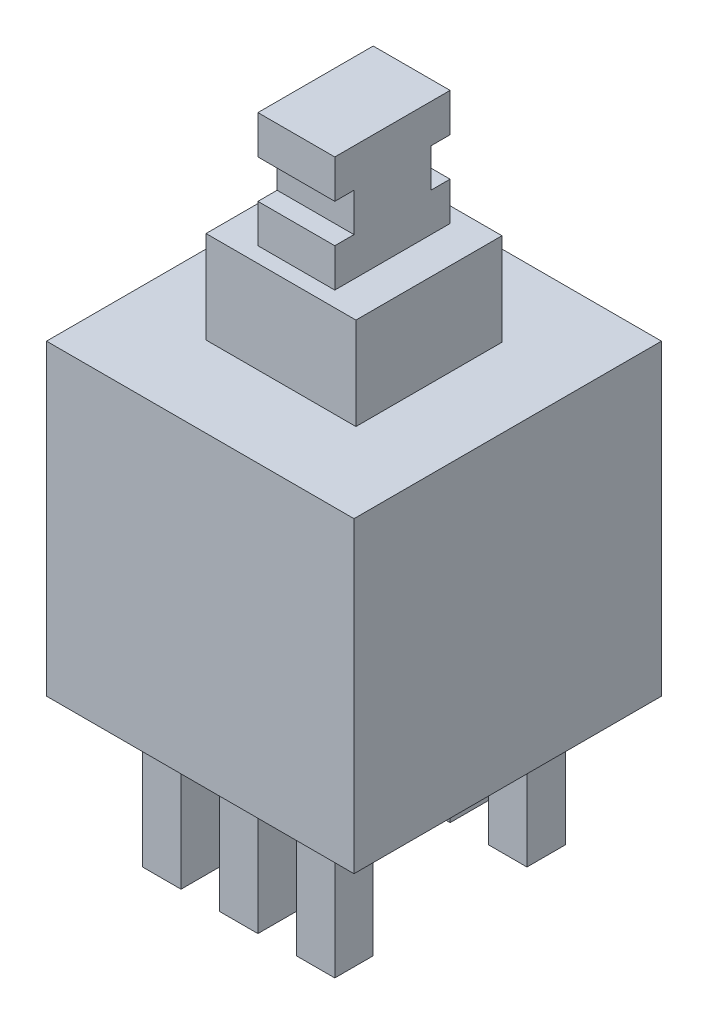
from build123d import *

# Parameters (mm, degrees)
SKETCH1_W           = 8
SKETCH1_H           = 8
BOSS_EXTRUDE1_DEPTH = 8
SKETCH2_W           = 3.9
SKETCH2_H           = 3.8
BOSS_EXTRUDE2_DEPTH = 2.4
SKETCH3_W           = 2
SKETCH3_H           = 3
BOSS_EXTRUDE3_DEPTH = 3
SKETCH4_W           = 1
SKETCH4_H           = 1
BOSS_EXTRUDE4_DEPTH = 3.6
SKETCH5_W           = 0.5
SKETCH5_H           = 1
CUT_EXTRUDE1_DEPTH  = 15.851262573


with BuildPart() as part:
    # Sketch1 → Boss-Extrude1 (new body)
    with BuildSketch(Plane(origin=(0, 0, 0), x_dir=(1, 0, 0), z_dir=(0, 1, 0))):
        Rectangle(SKETCH1_W, SKETCH1_H)
    extrude(amount=BOSS_EXTRUDE1_DEPTH)

    # Sketch2 → Boss-Extrude2 (add)
    with BuildSketch(Plane(origin=(0, 8, 0), x_dir=(1, 0, 0), z_dir=(0, 1, 0))):
        Rectangle(SKETCH2_W, SKETCH2_H)
    extrude(amount=BOSS_EXTRUDE2_DEPTH)

    # Sketch3 → Boss-Extrude3 (add)
    with BuildSketch(Plane(origin=(0, 10.4, 0), x_dir=(1, 0, 0), z_dir=(0, 1, 0))):
        Rectangle(SKETCH3_W, SKETCH3_H)
    extrude(amount=BOSS_EXTRUDE3_DEPTH)

    # Sketch4 → Boss-Extrude4 (add)
    with BuildSketch(Plane.XZ):
        with Locations((0, 2.5)):
            Rectangle(SKETCH4_W, SKETCH4_H)
        with Locations((-2, 2.5)):
            Rectangle(SKETCH4_W, SKETCH4_H)
        with Locations((2, 2.5)):
            Rectangle(SKETCH4_W, SKETCH4_H)
        with Locations((0, -2.5)):
            Rectangle(SKETCH4_W, SKETCH4_H)
        with Locations((2, -2.5)):
            Rectangle(SKETCH4_W, SKETCH4_H)
        with Locations((-2, -2.5)):
            Rectangle(SKETCH4_W, SKETCH4_H)
    extrude(amount=BOSS_EXTRUDE4_DEPTH)

    # Sketch5 → Cut-Extrude1 (cut, through all)
    with BuildSketch(Plane(origin=(1, 0, 0), x_dir=(0, 0, -1), z_dir=(1, 0, 0))):
        with Locations((-1.25, 11.9)):
            Rectangle(SKETCH5_W, SKETCH5_H)
        with Locations((1.25, 11.9)):
            Rectangle(SKETCH5_W, SKETCH5_H)
    extrude(amount=-CUT_EXTRUDE1_DEPTH, mode=Mode.SUBTRACT)


solid = part.part
